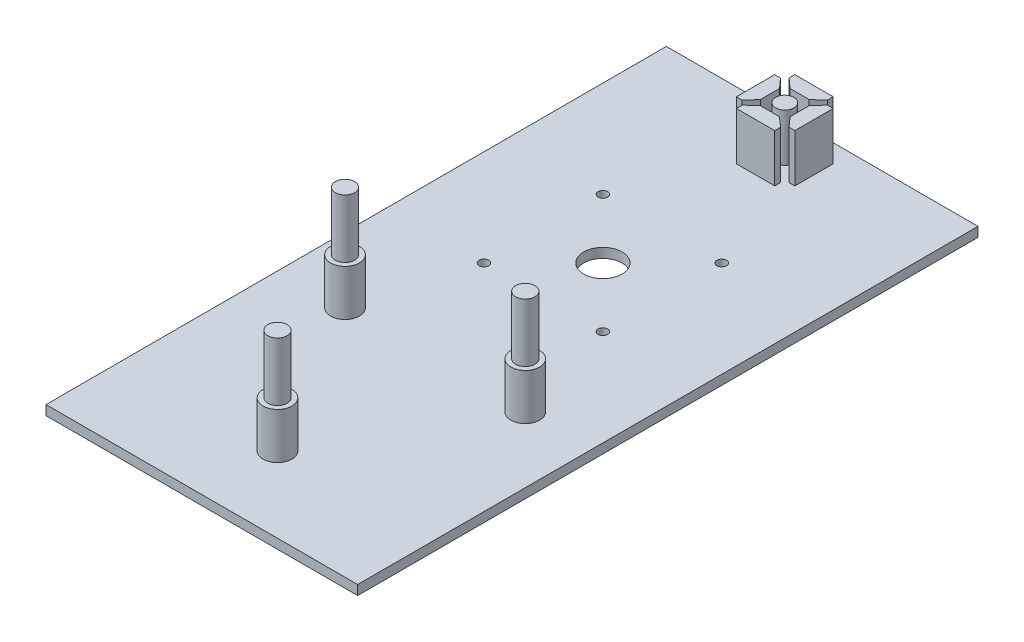
from build123d import *

# Parameters (mm, degrees)
SKETCH1_R               = 5.08
SKETCH1_R_2             = 1.27
BASE_EXTRUDE_DEPTH      = 2.54
SKETCH6_R               = 2.413
MIDDLE_BAR_HOLDER_DEPTH = 12.7
SKETCH7_R               = 2.55
BOSS_EXTRUDE6_DEPTH     = 27.686
SKETCH7_3_R             = 3.81
SKETCH7_3_R_2           = 2.55
BOSS_EXTRUDE7_DEPTH     = 12.192


with BuildPart() as part:
    # Sketch1 → base extrude (new body)
    with BuildSketch(Plane(origin=(0, 0, 0), x_dir=(1, 0, 0), z_dir=(0, 1, 0))):
        Polygon((82.55, -164.338), (82.55, -58.1000108), (82.55, 0), (0, 0), (0, -164.338), align=None)
        with Locations(Location((41.275, -58.1000108, 0), (0, 0, 270))):
            Circle(SKETCH1_R, mode=Mode.SUBTRACT)
        with Locations(Location((25.527, -42.3520108, 0), (0, 0, 270))):
            Circle(SKETCH1_R_2, mode=Mode.SUBTRACT)
        with Locations(Location((57.023, -42.3520108, 0), (0, 0, 270))):
            Circle(SKETCH1_R_2, mode=Mode.SUBTRACT)
        with Locations(Location((25.527, -73.8480108, 0), (0, 0, 270))):
            Circle(SKETCH1_R_2, mode=Mode.SUBTRACT)
        with Locations(Location((57.023, -73.8480108, 0), (0, 0, 270))):
            Circle(SKETCH1_R_2, mode=Mode.SUBTRACT)
    extrude(amount=BASE_EXTRUDE_DEPTH)

    # Sketch6 → middle bar holder (add)
    with BuildSketch(Plane(origin=(0, 2.54, 0), x_dir=(1, 0, 0), z_dir=(0, 1, 0))):
        Polygon((33.528, -9.906), (33.528, -4.826), (35.052, -4.826), (37.338, -7.366), (37.338, -9.906), (37.338, -12.446), (35.052, -14.986), (33.528, -14.986), align=None)
        with Locations(Location((41.275, -9.906, 0), (0, 0, 270))):
            Circle(SKETCH6_R)
        Polygon((41.275, -2.159), (46.355, -2.159), (46.355, -3.683), (43.815, -5.969), (41.275, -5.969), (38.735, -5.969), (36.195, -3.683), (36.195, -2.159), align=None)
        Polygon((47.498, -14.986), (45.212, -12.446), (45.212, -9.906), (45.212, -7.366), (47.498, -4.826), (49.022, -4.826), (49.022, -9.906), (49.022, -14.986), align=None)
        Polygon((41.275, -17.653), (36.195, -17.653), (36.195, -16.129), (38.735, -13.843), (41.275, -13.843), (43.815, -13.843), (46.355, -16.129), (46.355, -17.653), align=None)
    extrude(amount=MIDDLE_BAR_HOLDER_DEPTH)

    # Sketch7 → Boss-Extrude6 (add)
    with BuildSketch(Plane(origin=(0, 2.54, 0), x_dir=(1, 0, 0), z_dir=(0, 1, 0))):
        with Locations(Location((17.399, -102.529, 0), (0, 0, 270))):
            Circle(SKETCH7_R)
        with Locations(Location((41.275, -144.292, 0), (0, 0, 270))):
            Circle(SKETCH7_R)
        with Locations(Location((65.151, -102.529, 0), (0, 0, 270))):
            Circle(SKETCH7_R)
    extrude(amount=BOSS_EXTRUDE6_DEPTH)

    # Sketch7<3> → Boss-Extrude7 (add)
    # profile 1 of 3: a face of its own
    with BuildSketch(Plane(origin=(0, 2.54, 0), x_dir=(1, 0, 0), z_dir=(0, 1, 0))):
        with Locations(Location((41.275, -144.292, 0), (0, 0, 90))):
            Circle(SKETCH7_3_R)
        with Locations(Location((41.275, -144.292, 0), (0, 0, 270))):
            Circle(SKETCH7_3_R_2, mode=Mode.SUBTRACT)
    # profile 2 of 3: a face of its own
    with BuildSketch(Plane(origin=(0, 2.54, 0), x_dir=(1, 0, 0), z_dir=(0, 1, 0))):
        with Locations(Location((65.151, -102.529, 0), (0, 0, 90))):
            Circle(SKETCH7_3_R)
        with Locations(Location((65.151, -102.529, 0), (0, 0, 270))):
            Circle(SKETCH7_3_R_2, mode=Mode.SUBTRACT)
    # profile 3 of 3: a face of its own
    with BuildSketch(Plane(origin=(0, 2.54, 0), x_dir=(1, 0, 0), z_dir=(0, 1, 0))):
        with Locations(Location((17.399, -102.529, 0), (0, 0, 90))):
            Circle(SKETCH7_3_R)
        with Locations(Location((17.399, -102.529, 0), (0, 0, 270))):
            Circle(SKETCH7_3_R_2, mode=Mode.SUBTRACT)
    extrude(amount=BOSS_EXTRUDE7_DEPTH)


solid = part.part
